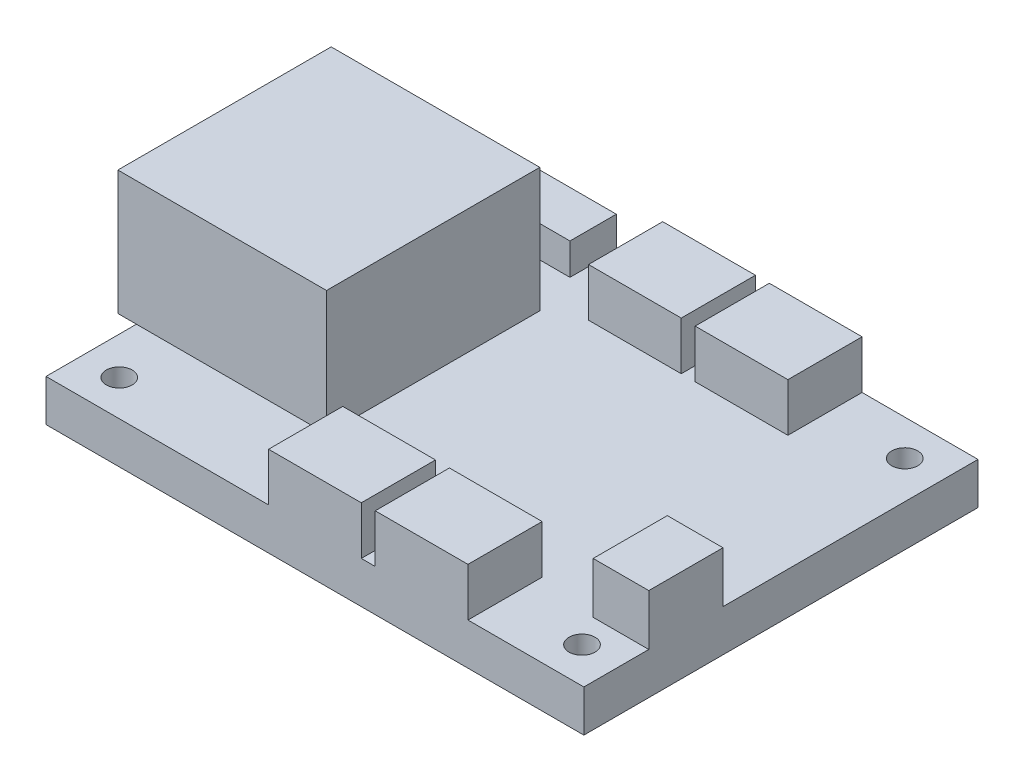
from build123d import *

# Parameters (mm, degrees)
SKETCH1_W           = 58
SKETCH1_H           = 42.5
SKETCH1_R           = 1.4
BOSS_EXTRUDE1_DEPTH = 4.5
SKETCH2_W           = 22.5
SKETCH2_H           = 23
BOSS_EXTRUDE2_DEPTH = 13.4
SKETCH2_3_W         = 10
SKETCH2_3_H         = 8
BOSS_EXTRUDE3_DEPTH = 5.2
SKETCH2_4_W         = 6
SKETCH2_4_H         = 8
BOSS_EXTRUDE4_DEPTH = 5.5
SKETCH2_5_W         = 9
SKETCH2_5_H         = 5
BOSS_EXTRUDE5_DEPTH = 3.4


with BuildPart() as part:
    # Sketch1 → Boss-Extrude1 (new body)
    with BuildSketch(Plane(origin=(0, 0, 0), x_dir=(1, 0, 0), z_dir=(0, 1, 0))):
        Rectangle(SKETCH1_W, SKETCH1_H)
        with Locations((-24.95, 17.4)):
            Circle(SKETCH1_R, mode=Mode.SUBTRACT)
        with Locations((24.95, 17.4)):
            Circle(SKETCH1_R, mode=Mode.SUBTRACT)
        with Locations((24.95, -17.4)):
            Circle(SKETCH1_R, mode=Mode.SUBTRACT)
        with Locations((-24.95, -17.4)):
            Circle(SKETCH1_R, mode=Mode.SUBTRACT)
    extrude(amount=BOSS_EXTRUDE1_DEPTH)

    # Sketch2 → Boss-Extrude2 (add)
    with BuildSketch(Plane(origin=(0, 4.5, 0), x_dir=(1, 0, 0), z_dir=(0, 1, 0))):
        with Locations((-19.75, 0)):
            Rectangle(SKETCH2_W, SKETCH2_H)
    extrude(amount=BOSS_EXTRUDE2_DEPTH)

    # Sketch2<3> → Boss-Extrude3 (add)
    with BuildSketch(Plane(origin=(0, 4.5, 0), x_dir=(1, 0, 0), z_dir=(0, 1, 0))):
        with Locations((11.5, 17.25)):
            Rectangle(SKETCH2_3_W, SKETCH2_3_H)
        with Locations((0, 17.25)):
            Rectangle(SKETCH2_3_W, SKETCH2_3_H)
        with Locations((0, -17.25)):
            Rectangle(SKETCH2_3_W, SKETCH2_3_H)
        with Locations((11.5, -17.25)):
            Rectangle(SKETCH2_3_W, SKETCH2_3_H)
    extrude(amount=BOSS_EXTRUDE3_DEPTH)

    # Sketch2<4> → Boss-Extrude4 (add)
    with BuildSketch(Plane(origin=(0, 4.5, 0), x_dir=(1, 0, 0), z_dir=(0, 1, 0))):
        with Locations((26, -10.25)):
            Rectangle(SKETCH2_4_W, SKETCH2_4_H)
    extrude(amount=BOSS_EXTRUDE4_DEPTH)

    # Sketch2<5> → Boss-Extrude5 (add)
    with BuildSketch(Plane(origin=(0, 4.5, 0), x_dir=(1, 0, 0), z_dir=(0, 1, 0))):
        with Locations((-14.5, 18.75)):
            Rectangle(SKETCH2_5_W, SKETCH2_5_H)
    extrude(amount=BOSS_EXTRUDE5_DEPTH)


solid = part.part
